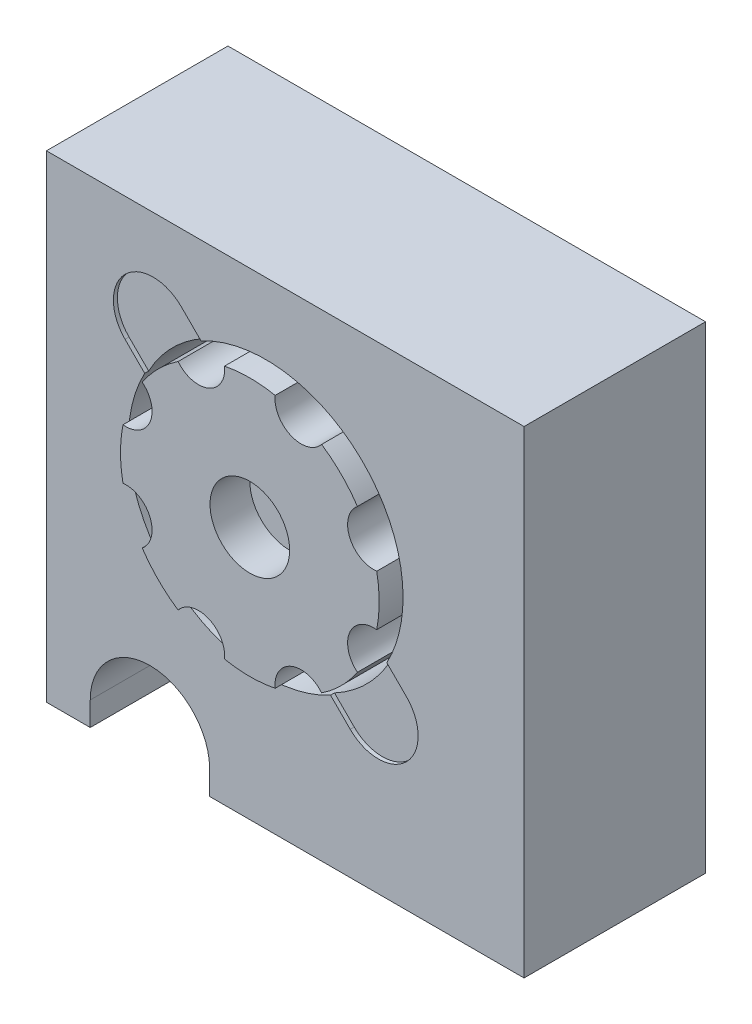
from build123d import *

# Parameters (mm, degrees)
SKETCH1_W           = 6
SKETCH1_H           = 6
BOSS_EXTRUDE1_DEPTH = 2.28
SKETCH2_R           = 1.725
CUT_EXTRUDE1_DEPTH  = 1
CUT_EXTRUDE2_DEPTH  = 0.05
CUT_EXTRUDE3_DEPTH  = 1
SKETCH5_R           = 1.625
BOSS_EXTRUDE2_DEPTH = 1.2
CUT_EXTRUDE6_DEPTH  = 1.2
SKETCH7_R           = 0.5
CUT_EXTRUDE7_DEPTH  = 0.5


with BuildPart() as part:
    # Sketch1 → Boss-Extrude1 (new body)
    with BuildSketch(Plane.XY):
        Rectangle(SKETCH1_W, SKETCH1_H)
    extrude(amount=BOSS_EXTRUDE1_DEPTH)

    # Sketch2 → Cut-Extrude1 (cut)
    with BuildSketch(Plane.XY.offset(2.28)):
        with Locations((-0.245, 0.382)):
            Circle(SKETCH2_R)
    extrude(amount=-CUT_EXTRUDE1_DEPTH, mode=Mode.SUBTRACT)

    # Sketch3 → Cut-Extrude2 (cut)
    with BuildSketch(Plane.XY.offset(2.28)):
        with BuildLine():
            Line((0.815660172, -1.385766953), (-2.012766953, 1.442660172))
            ThreePointArc((-2.012766953, 1.442660172), (-2.012766953, 2.149766953), (-1.305660172, 2.149766953))
            Line((-1.305660172, 2.149766953), (1.522766953, -0.678660172))
            ThreePointArc((1.522766953, -0.678660172), (1.522766953, -1.385766953), (0.815660172, -1.385766953))
        make_face()
    extrude(amount=-CUT_EXTRUDE2_DEPTH, mode=Mode.SUBTRACT)

    # Sketch4 → Cut-Extrude3 (cut)
    with BuildSketch(Plane.XY.offset(2.28)):
        with BuildLine():
            Line((-2.45, -2.7), (-2.45, -3))
            Line((-2.45, -3), (-0.95, -3))
            Line((-0.95, -3), (-0.95, -2.7))
            ThreePointArc((-0.95, -2.7), (-1.7, -1.95), (-2.45, -2.7))
        make_face()
    extrude(amount=-CUT_EXTRUDE3_DEPTH, mode=Mode.SUBTRACT)

    # Sketch5 → Boss-Extrude2 (add)
    with BuildSketch(Plane.XY.offset(1.28)):
        with Locations((-0.245, 0.382)):
            Circle(SKETCH5_R)
    extrude(amount=BOSS_EXTRUDE2_DEPTH)

    # Sketch6 → Cut-Extrude6 (cut)
    with BuildSketch(Plane.XY.offset(2.48)):
        with BuildLine():
            ThreePointArc((-1.897587238, 0.051650147), (-1.801997597, -0.262929521), (-1.647148264, -0.552963022))
            ThreePointArc((-1.647148264, -0.552963022), (-1.498242435, -0.137110013), (-1.897587238, 0.051650147))
        make_face()
        with BuildLine():
            ThreePointArc((0.085349853, 2.034587238), (0.274110013, 1.635242435), (0.689963022, 1.784148264))
            ThreePointArc((0.689963022, 1.784148264), (0.399929521, 1.938997597), (0.085349853, 2.034587238))
        make_face()
        with BuildLine():
            ThreePointArc((1.157148264, 1.316963022), (1.008242435, 0.901110013), (1.407587238, 0.712349853))
            ThreePointArc((1.407587238, 0.712349853), (1.311997597, 1.026929521), (1.157148264, 1.316963022))
        make_face()
        with BuildLine():
            ThreePointArc((1.407587238, 0.051650147), (1.008242435, -0.137110013), (1.157148264, -0.552963022))
            ThreePointArc((1.157148264, -0.552963022), (1.311997597, -0.262929521), (1.407587238, 0.051650147))
        make_face()
        with BuildLine():
            ThreePointArc((0.689963022, -1.020148264), (0.274110013, -0.871242435), (0.085349853, -1.270587238))
            ThreePointArc((0.085349853, -1.270587238), (0.399929521, -1.174997597), (0.689963022, -1.020148264))
        make_face()
        with BuildLine():
            ThreePointArc((-0.575349853, -1.270587238), (-0.764110013, -0.871242435), (-1.179963022, -1.020148264))
            ThreePointArc((-1.179963022, -1.020148264), (-0.889929521, -1.174997597), (-0.575349853, -1.270587238))
        make_face()
        with BuildLine():
            ThreePointArc((-1.897587238, 0.712349853), (-1.498242435, 0.901110013), (-1.647148264, 1.316963022))
            ThreePointArc((-1.647148264, 1.316963022), (-1.801997597, 1.026929521), (-1.897587238, 0.712349853))
        make_face()
        with BuildLine():
            ThreePointArc((-1.179963022, 1.784148264), (-0.764110013, 1.635242435), (-0.575349853, 2.034587238))
            ThreePointArc((-0.575349853, 2.034587238), (-0.889929521, 1.938997597), (-1.179963022, 1.784148264))
        make_face()
    extrude(amount=-CUT_EXTRUDE6_DEPTH, mode=Mode.SUBTRACT)

    # Sketch7 → Cut-Extrude7 (cut)
    with BuildSketch(Plane.XY.offset(2.48)):
        with Locations((-0.245, 0.382)):
            Circle(SKETCH7_R)
    extrude(amount=-CUT_EXTRUDE7_DEPTH, mode=Mode.SUBTRACT)


solid = part.part
